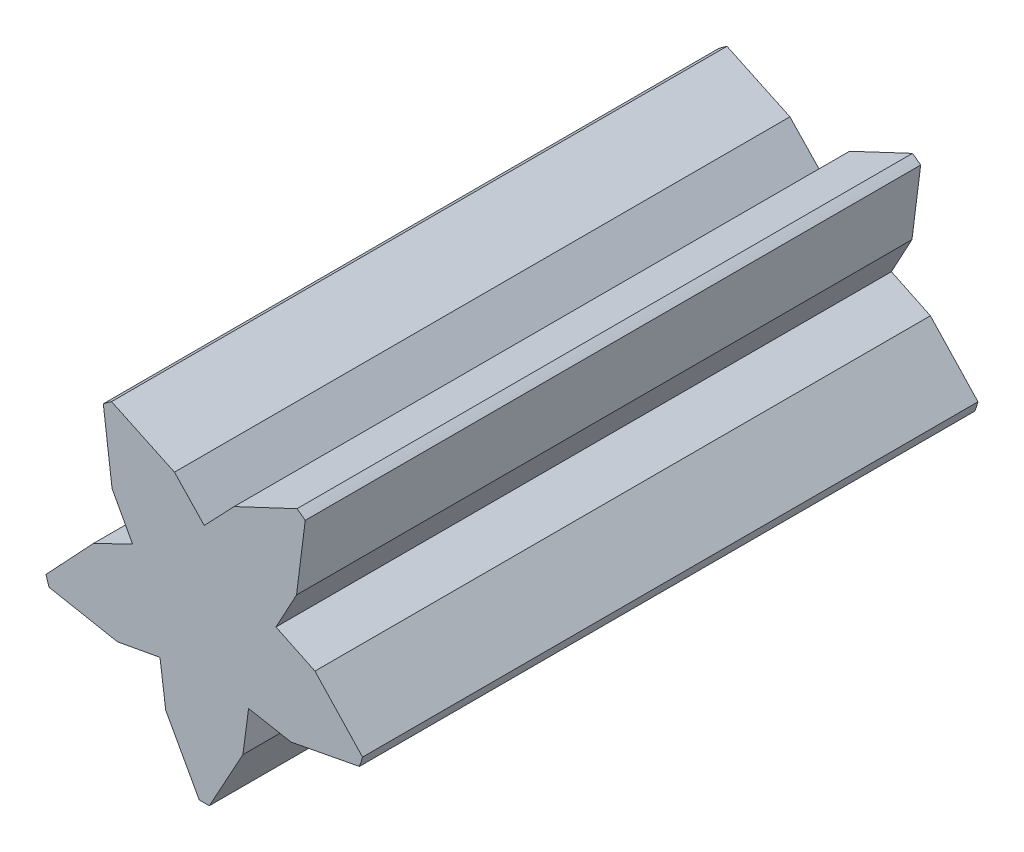
from build123d import *

# Parameters (mm, degrees)
SKETCH1_R           = 7.5
BOSS_EXTRUDE1_DEPTH = 28
CUT_EXTRUDE1_DEPTH  = 30.941609843
CIRPATTERN1_COUNT   = 5


with BuildPart() as part:
    # Sketch1 → Boss-Extrude1 (new body)
    with BuildSketch(Plane.XY):
        Circle(SKETCH1_R)
    extrude(amount=BOSS_EXTRUDE1_DEPTH)

    # Sketch2 → Cut-Extrude1 (cut, through all)
    with BuildSketch(Plane.XY):
        Polygon((0, 3.429306859), (-1.35645876, 4.852854397), (-4.219139018, 6.200714954), (0, 11.25164702), (4.219139018, 6.200714954), (1.35645876, 4.852854397), align=None)
    cut_extrude1 = extrude(amount=CUT_EXTRUDE1_DEPTH, mode=Mode.SUBTRACT)

    # CirPattern1: Cut-Extrude1 ×5 about axis
    cirpattern1_axis = Axis((0, 0, 0), (0, 0, 1))
    for i in range(1, CIRPATTERN1_COUNT):
        add(cut_extrude1.rotate(cirpattern1_axis, i * 360 / CIRPATTERN1_COUNT), mode=Mode.SUBTRACT)


solid = part.part
